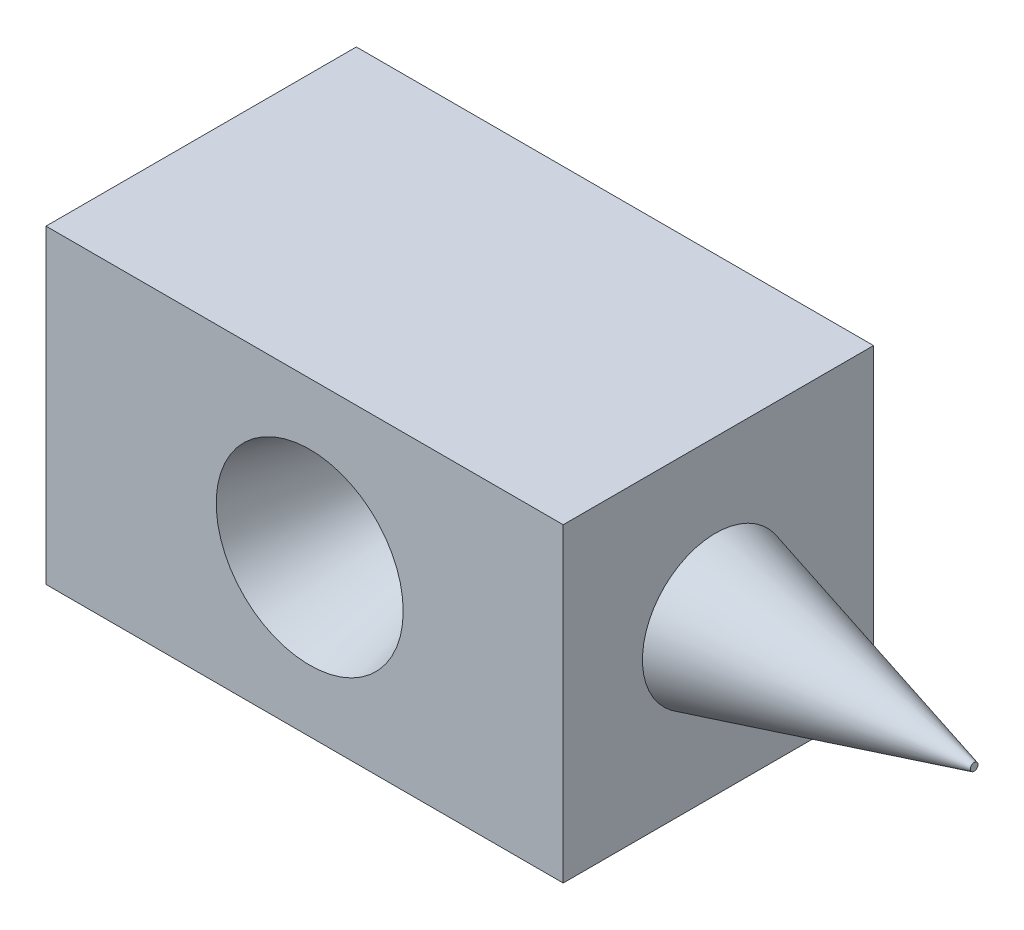
from build123d import *

# Parameters (mm, degrees)
SKETCH1_W           = 127
SKETCH1_H           = 76.2
BOSS_EXTRUDE1_DEPTH = 76.2
SKETCH2_R           = 22.957981207
CUT_EXTRUDE1_DEPTH  = 50.8
CUT_EXTRUDE1_DRAFT  = -15
SKETCH3_R           = 17.955133558
BOSS_EXTRUDE2_DEPTH = 63.5
BOSS_EXTRUDE2_TAPER = 15


with BuildPart() as part:
    # Sketch1 → Boss-Extrude1 (new body)
    with BuildSketch(Plane.XY):
        with Locations((63.5, 38.1)):
            Rectangle(SKETCH1_W, SKETCH1_H)
    extrude(amount=BOSS_EXTRUDE1_DEPTH)


with BuildPart() as cut_extrude1_tool:
    # Sketch2 → Cut-Extrude1 (with draft: the straight prism first)
    with BuildSketch(Plane.XY.offset(76.2)):
        with Locations((64.753202194, 38.155586657)):
            Circle(SKETCH2_R)
    extrude(amount=-CUT_EXTRUDE1_DEPTH)
    # Cut-Extrude1: the draft: its side faces are tilted about the plane it starts from
    cut_extrude1_sides = [cut_extrude1_tool.faces().sort_by_distance(p)[0] for p in [
        (41.795220987, 38.155586657, 50.8),
    ]]
    draft(cut_extrude1_sides, Plane.XY.offset(76.2), CUT_EXTRUDE1_DRAFT)


with BuildPart() as part_1:
    add(part.part)

    # Cut-Extrude1: cut by cut_extrude1_tool
    add(cut_extrude1_tool.part, mode=Mode.SUBTRACT)

    # Sketch3 → Boss-Extrude2 (add)
    with BuildSketch(Plane(origin=(127, 0, 0), x_dir=(0, 0, -1), z_dir=(1, 0, 0))):
        with Locations((-38.791271087, 37.754364457)):
            Circle(SKETCH3_R)
    extrude(amount=BOSS_EXTRUDE2_DEPTH, taper=BOSS_EXTRUDE2_TAPER)


solid = part_1.part
